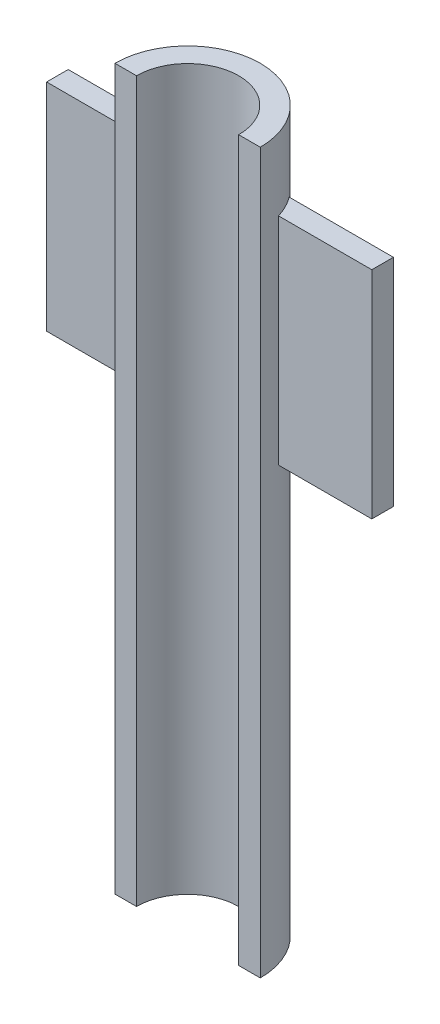
from build123d import *

# Parameters (mm, degrees)
SKETCH1_R           = 10.1
SKETCH1_R_2         = 7.1
BOSS_EXTRUDE1_DEPTH = 50
SKETCH3_W           = 203.170281232
SKETCH3_H           = 205.602397066
CUT_EXTRUDE1_DEPTH  = 53.000192307
SKETCH6_W           = 15
SKETCH6_H           = 30
BOSS_EXTRUDE4_DEPTH = 1.5
BOSS_EXTRUDE5_DEPTH = 1.5


with BuildPart() as part:
    # Sketch1 → Boss-Extrude1 (new, symmetric)
    with BuildSketch(Plane(origin=(0, 0, 0), x_dir=(1, 0, 0), z_dir=(0, 1, 0))):
        with Locations(Location((0, 0, 0), (0, 0, 270))):
            Circle(SKETCH1_R)
        with Locations(Location((0, 0, 0), (0, 0, 270))):
            Circle(SKETCH1_R_2, mode=Mode.SUBTRACT)
    extrude(amount=BOSS_EXTRUDE1_DEPTH, both=True)

    # Sketch3 → Cut-Extrude1 (cut, through all)
    with BuildSketch(Plane.XY):
        Rectangle(SKETCH3_W, SKETCH3_H)
    extrude(amount=CUT_EXTRUDE1_DEPTH, mode=Mode.SUBTRACT)

    # Sketch6 → Boss-Extrude4 (add, symmetric)
    with BuildSketch(Plane.XY.offset(-4.5)):
        with Locations((15.1, 25)):
            Rectangle(SKETCH6_W, SKETCH6_H)
        with Locations((-15.1, 25)):
            Rectangle(SKETCH6_W, SKETCH6_H)
    extrude(amount=BOSS_EXTRUDE4_DEPTH, both=True)

    # Sketch7 → Boss-Extrude5 (add)
    # profile 1 of 10: a face of its own
    with BuildSketch(Plane(origin=(0, 0, -6), x_dir=(-1, 0, 0), z_dir=(0, 0, -1))):
        Polygon((18.272743586, 27.57751444), (18.272743586, 27.119263739), (15.362326919, 26.380582265), (15.362326919, 26.917540148), (15.996648501, 27.078452608), (15.996648501, 28.213585069), (15.362326919, 28.554066506), (15.362326919, 29.141746795), align=None)
        Polygon((16.481717945, 27.202635049), (17.430285236, 27.442254691), (16.481717945, 27.952976846), align=None, mode=Mode.SUBTRACT)
    # profile 2 of 10: a face of its own
    with BuildSketch(Plane(origin=(0, 0, -6), x_dir=(-1, 0, 0), z_dir=(0, 0, -1))):
        with BuildLine():
            Line((17.4145438, 25.298504274), (17.4145438, 25.820886752))
            add(Edge.make_bspline(
                [(17.4145438, 25.820886752), (17.460723136, 25.817842501), (17.550828394, 25.811902549), (17.680949713, 25.785822497), (17.802249114, 25.746851672), (17.913494395, 25.694287528), (18.01420003, 25.630921257), (18.102459696, 25.557128683), (18.177734624, 25.473117632), (18.239354644, 25.379621177), (18.28823979, 25.278082916), (18.322543695, 25.169324736), (18.343459462, 25.053857316), (18.346046688, 24.97463113), (18.347369654, 24.934119174)],
                knots=[0, 0, 0, 0, 1.15710901, 2.257754567, 3.311243163, 4.338082744, 5.328386743, 6.281089782, 7.20757636, 8.14096805, 9.07413166, 10.01848154, 10.986759394, 12, 12, 12, 12], degree=3))
            add(Edge.make_bspline(
                [(18.347369654, 24.934119174), (18.346771729, 24.904737387), (18.345599109, 24.847115318), (18.334177733, 24.762575129), (18.315677219, 24.68213456), (18.289727639, 24.605363058), (18.256653549, 24.532614201), (18.215926297, 24.463688741), (18.167982877, 24.398724436), (18.112815906, 24.338629381), (18.052444976, 24.284039173), (17.987956896, 24.235817534), (17.919908141, 24.194892896), (17.847838052, 24.161988294), (17.772406308, 24.136367619), (17.693387308, 24.117648964), (17.610769337, 24.106289693), (17.554503892, 24.10509469), (17.525899886, 24.104487179)],
                knots=[0, 0, 0, 0, 1.079543272, 2.117145465, 3.12912697, 4.109553083, 5.090967661, 6.061295998, 7.0471464, 8.053388092, 9.054825723, 10.034939483, 11.008916128, 11.967870454, 12.941532676, 13.932648969, 14.949008208, 16, 16, 16, 16], degree=3))
            add(Edge.make_bspline(
                [(17.525899886, 24.104487179), (17.502355613, 24.105045103), (17.454721149, 24.106173885), (17.382887449, 24.115609666), (17.309481508, 24.129253991), (17.234941311, 24.150296346), (17.158448595, 24.175637013), (17.080880515, 24.207685653), (17.001319326, 24.24408704), (16.934450122, 24.280354228), (16.878391005, 24.313081833), (16.832930166, 24.342610056), (16.78378104, 24.375547026), (16.732245586, 24.414104332), (16.675906204, 24.454885664), (16.617512121, 24.501462736), (16.554705169, 24.550642107), (16.489654767, 24.605227565), (16.420809393, 24.663471175), (16.348604942, 24.725741777), (16.273159486, 24.792364258), (16.194868773, 24.863568319), (16.112232811, 24.938113086), (16.027022099, 25.017342868), (15.93794995, 25.100245909), (15.878042884, 25.157351695), (15.847396364, 25.186565171)],
                knots=[0, 0, 0, 0, 0.830114445, 1.679476586, 2.551951687, 3.461549647, 4.408799845, 5.392739447, 6.420129466, 7.493481945, 8.074224777, 8.709302655, 9.40513743, 10.16057533, 10.979032967, 11.857973419, 12.79467404, 13.792554112, 14.852781522, 15.975451208, 17.155498061, 18.4027528, 19.708099789, 21.080817988, 22.506640743, 24, 24, 24, 24], degree=3))
            Line((15.847396364, 25.186565171), (15.847396364, 24.216426282))
            Line((15.847396364, 24.216426282), (15.362326919, 24.28055806))
            Line((15.362326919, 24.28055806), (15.362326919, 26.044764957))
            Line((15.362326919, 26.044764957), (15.735457261, 26.007451923))
            add(Edge.make_bspline(
                [(15.735457261, 26.007451923), (15.766944672, 25.977334255), (15.828529575, 25.918428375), (15.918649125, 25.832074941), (16.005377199, 25.750529369), (16.087326389, 25.672123697), (16.166044816, 25.598503706), (16.240306696, 25.52816793), (16.310446248, 25.461866187), (16.377151443, 25.400130599), (16.439422625, 25.342078172), (16.498566254, 25.28895232), (16.552382242, 25.238334049), (16.60327136, 25.193055984), (16.650107886, 25.151689485), (16.69223595, 25.113689652), (16.731093904, 25.080501281), (16.755357924, 25.059480282), (16.766812847, 25.049556374)],
                knots=[0, 0, 0, 0, 1.485706908, 2.905831718, 4.255813778, 5.544779497, 6.772986801, 7.930802167, 9.032413688, 10.063933681, 11.029901119, 11.935210493, 12.774579406, 13.548857665, 14.257643472, 14.905346069, 15.483219369, 16, 16, 16, 16], degree=3))
            add(Edge.make_bspline(
                [(16.766812847, 25.049556374), (16.795311298, 25.025957683), (16.850014649, 24.980659523), (16.929647764, 24.916957255), (17.004071533, 24.861070822), (17.071820341, 24.811209327), (17.134628836, 24.769088351), (17.19121192, 24.733568057), (17.242039137, 24.704949745), (17.27471379, 24.690215435), (17.289778342, 24.683422226)],
                knots=[0, 0, 0, 0, 1.387145642, 2.662653962, 3.822537019, 4.876163332, 5.815785708, 6.656796686, 7.380720103, 8, 8, 8, 8], degree=3))
            add(Edge.make_bspline(
                [(17.289778342, 24.683422226), (17.311218487, 24.674890042), (17.353130885, 24.658210851), (17.416856772, 24.639956039), (17.479654239, 24.629002213), (17.521194898, 24.627573081), (17.541641322, 24.626869658)],
                knots=[0, 0, 0, 0, 1.065166925, 2.082248014, 3.056077273, 4, 4, 4, 4], degree=3))
            add(Edge.make_bspline(
                [(17.541641322, 24.626869658), (17.563696901, 24.628037645), (17.606692401, 24.630314539), (17.668434759, 24.646692604), (17.723892203, 24.675453516), (17.771974485, 24.714744512), (17.812354356, 24.761412802), (17.84156305, 24.81505383), (17.858999232, 24.873971992), (17.861184988, 24.914956837), (17.86230021, 24.935868222)],
                knots=[0, 0, 0, 0, 1.065210966, 2.076539412, 3.059259361, 4.060863691, 5.060000142, 6.022229399, 6.990897182, 8, 8, 8, 8], degree=3))
            add(Edge.make_bspline(
                [(17.86230021, 24.935868222), (17.861123833, 24.958167086), (17.858839621, 25.001465564), (17.839267431, 25.063443828), (17.807090982, 25.119318656), (17.769863632, 25.160201459), (17.733556801, 25.189394042), (17.70166148, 25.210342627), (17.664739281, 25.229014994), (17.623620714, 25.246299628), (17.577864825, 25.262124411), (17.527513097, 25.275773079), (17.472815601, 25.289003934), (17.434417745, 25.295264126), (17.4145438, 25.298504274)],
                knots=[0, 0, 0, 0, 1.261989429, 2.450448752, 3.644971293, 4.893175475, 5.559158705, 6.283478895, 7.052279547, 7.901593451, 8.811103815, 9.794938439, 10.858705195, 12, 12, 12, 12], degree=3))
        make_face()
    # profile 3 of 10: a face of its own
    with BuildSketch(Plane(origin=(0, 0, -6), x_dir=(-1, 0, 0), z_dir=(0, 0, -1))):
        Polygon((18.272743586, 23.288847573), (18.272743586, 22.800280031), (16.293986742, 21.772422543), (18.272743586, 21.494906851), (18.272743586, 20.967860243), (15.362326919, 21.375388538), (15.362326919, 21.861040999), (17.362655362, 22.891813568), (15.362326919, 23.171661325), (15.362326919, 23.698124917), align=None)
    # profile 4 of 10: a face of its own
    with BuildSketch(Plane(origin=(0, 0, -6), x_dir=(-1, 0, 0), z_dir=(0, 0, -1))):
        with BuildLine():
            Line((11.302658116, 34.682732372), (11.302658116, 35.20511485))
            add(Edge.make_bspline(
                [(11.302658116, 35.20511485), (11.348837452, 35.202070599), (11.438942711, 35.196130647), (11.569064029, 35.170050595), (11.69036343, 35.13107977), (11.801608711, 35.078515626), (11.902314346, 35.015149355), (11.990574012, 34.941356781), (12.065848941, 34.85734573), (12.12746896, 34.763849275), (12.176354106, 34.662311014), (12.210658011, 34.553552834), (12.231573778, 34.438085414), (12.234161004, 34.358859228), (12.235483971, 34.318347272)],
                knots=[0, 0, 0, 0, 1.15710901, 2.257754567, 3.311243163, 4.338082744, 5.328386743, 6.281089782, 7.20757636, 8.14096805, 9.07413166, 10.01848154, 10.986759394, 12, 12, 12, 12], degree=3))
            add(Edge.make_bspline(
                [(12.235483971, 34.318347272), (12.234886046, 34.288965485), (12.233713425, 34.231343416), (12.22229205, 34.146803227), (12.203791536, 34.066362658), (12.177841956, 33.989591156), (12.144767865, 33.916842299), (12.104040613, 33.847916839), (12.056097193, 33.782952534), (12.000930223, 33.722857479), (11.940559293, 33.668267271), (11.876071212, 33.620045633), (11.808022457, 33.579120994), (11.735952368, 33.546216393), (11.660520624, 33.520595717), (11.581501624, 33.501877062), (11.498883654, 33.490517792), (11.442618208, 33.489322789), (11.414014202, 33.488715278)],
                knots=[0, 0, 0, 0, 1.079543272, 2.117145465, 3.12912697, 4.109553083, 5.090967661, 6.061295998, 7.0471464, 8.053388092, 9.054825723, 10.034939483, 11.008916128, 11.967870454, 12.941532676, 13.932648969, 14.949008208, 16, 16, 16, 16], degree=3))
            add(Edge.make_bspline(
                [(11.414014202, 33.488715278), (11.390469929, 33.489273201), (11.342835465, 33.490401983), (11.271001765, 33.499837764), (11.197595824, 33.513482089), (11.123055627, 33.534524445), (11.046562911, 33.559865112), (10.968994831, 33.591913752), (10.889433642, 33.628315138), (10.822564438, 33.664582326), (10.766505321, 33.697309931), (10.721044482, 33.726838155), (10.671895356, 33.759775124), (10.620359902, 33.79833243), (10.56402052, 33.839113762), (10.505626437, 33.885690834), (10.442819485, 33.934870205), (10.377769083, 33.989455663), (10.308923709, 34.047699273), (10.236719258, 34.109969876), (10.161273802, 34.176592357), (10.082983089, 34.247796417), (10.000347127, 34.322341185), (9.915136415, 34.401570966), (9.826064266, 34.484474007), (9.7661572, 34.541579793), (9.73551068, 34.570793269)],
                knots=[0, 0, 0, 0, 0.830114445, 1.679476586, 2.551951687, 3.461549647, 4.408799845, 5.392739447, 6.420129466, 7.493481945, 8.074224777, 8.709302655, 9.40513743, 10.16057533, 10.979032967, 11.857973419, 12.79467404, 13.792554112, 14.852781522, 15.975451208, 17.155498061, 18.4027528, 19.708099789, 21.080817988, 22.506640743, 24, 24, 24, 24], degree=3))
            Line((9.73551068, 34.570793269), (9.73551068, 33.60065438))
            Line((9.73551068, 33.60065438), (9.250441236, 33.664786158))
            Line((9.250441236, 33.664786158), (9.250441236, 35.428993056))
            Line((9.250441236, 35.428993056), (9.623571578, 35.391680021))
            add(Edge.make_bspline(
                [(9.623571578, 35.391680021), (9.655058988, 35.361562354), (9.716643891, 35.302656473), (9.806763442, 35.216303039), (9.893491515, 35.134757467), (9.975440705, 35.056351795), (10.054159132, 34.982731805), (10.128421013, 34.912396028), (10.198560564, 34.846094285), (10.265265759, 34.784358697), (10.327536941, 34.726306271), (10.38668057, 34.673180418), (10.440496558, 34.622562148), (10.491385676, 34.577284082), (10.538222202, 34.535917583), (10.580350266, 34.497917751), (10.61920822, 34.464729379), (10.643472241, 34.44370838), (10.654927163, 34.433784472)],
                knots=[0, 0, 0, 0, 1.485706908, 2.905831718, 4.255813778, 5.544779497, 6.772986801, 7.930802167, 9.032413688, 10.063933681, 11.029901119, 11.935210493, 12.774579406, 13.548857665, 14.257643472, 14.905346069, 15.483219369, 16, 16, 16, 16], degree=3))
            add(Edge.make_bspline(
                [(10.654927163, 34.433784472), (10.683425614, 34.410185782), (10.738128965, 34.364887621), (10.81776208, 34.301185353), (10.892185849, 34.24529892), (10.959934658, 34.195437425), (11.022743153, 34.153316449), (11.079326236, 34.117796155), (11.130153454, 34.089177843), (11.162828106, 34.074443533), (11.177892658, 34.067650324)],
                knots=[0, 0, 0, 0, 1.387145642, 2.662653962, 3.822537019, 4.876163332, 5.815785708, 6.656796686, 7.380720103, 8, 8, 8, 8], degree=3))
            add(Edge.make_bspline(
                [(11.177892658, 34.067650324), (11.199332803, 34.05911814), (11.241245202, 34.042438949), (11.304971089, 34.024184138), (11.367768555, 34.013230312), (11.409309214, 34.011801179), (11.429755639, 34.011097756)],
                knots=[0, 0, 0, 0, 1.065166925, 2.082248014, 3.056077273, 4, 4, 4, 4], degree=3))
            add(Edge.make_bspline(
                [(11.429755639, 34.011097756), (11.451811217, 34.012265744), (11.494806717, 34.014542637), (11.556549076, 34.030920702), (11.612006519, 34.059681614), (11.660088801, 34.09897261), (11.700468672, 34.1456409), (11.729677366, 34.199281929), (11.747113548, 34.258200091), (11.749299305, 34.299184936), (11.750414526, 34.320096321)],
                knots=[0, 0, 0, 0, 1.065210966, 2.076539412, 3.059259361, 4.060863691, 5.060000142, 6.022229399, 6.990897182, 8, 8, 8, 8], degree=3))
            add(Edge.make_bspline(
                [(11.750414526, 34.320096321), (11.749238149, 34.342395184), (11.746953937, 34.385693663), (11.727381747, 34.447671926), (11.695205298, 34.503546754), (11.657977948, 34.544429557), (11.621671117, 34.57362214), (11.589775796, 34.594570725), (11.552853597, 34.613243093), (11.51173503, 34.630527726), (11.465979141, 34.646352509), (11.415627413, 34.660001177), (11.360929917, 34.673232032), (11.322532062, 34.679492224), (11.302658116, 34.682732372)],
                knots=[0, 0, 0, 0, 1.261989429, 2.450448752, 3.644971293, 4.893175475, 5.559158705, 6.283478895, 7.052279547, 7.901593451, 8.811103815, 9.794938439, 10.858705195, 12, 12, 12, 12], degree=3))
        make_face()
    # profile 5 of 10: a face of its own
    with BuildSketch(Plane(origin=(0, 0, -6), x_dir=(-1, 0, 0), z_dir=(0, 0, -1))):
        with BuildLine():
            Line((11.377284184, 32.8508956), (11.377284184, 32.323848992))
            Line((11.377284184, 32.323848992), (11.158070108, 32.355331864))
            add(Edge.make_bspline(
                [(11.158070108, 32.355331864), (11.17845255, 32.331531266), (11.218516689, 32.284748326), (11.271411753, 32.21058849), (11.315004701, 32.133704433), (11.351913685, 32.055205332), (11.379507223, 31.973926554), (11.40046442, 31.890775942), (11.412066365, 31.805293713), (11.413750192, 31.747666708), (11.414597219, 31.718678218)],
                knots=[0, 0, 0, 0, 1.069944556, 2.103104732, 3.105026839, 4.085031541, 5.061094812, 6.031817439, 7.009932236, 8, 8, 8, 8], degree=3))
            add(Edge.make_bspline(
                [(11.414597219, 31.718678218), (11.414111375, 31.695127751), (11.413151781, 31.648612996), (11.403284636, 31.580165974), (11.38847776, 31.513847859), (11.366696943, 31.451098382), (11.341345749, 31.39201887), (11.311742518, 31.338570604), (11.278776973, 31.290682663), (11.242216787, 31.247887786), (11.199843536, 31.20936194), (11.149349289, 31.176294751), (11.09304733, 31.143470891), (11.051420014, 31.126050462), (11.029806553, 31.117005542)],
                knots=[0, 0, 0, 0, 1.109749996, 2.191877839, 3.254428669, 4.309245986, 5.318789372, 6.282718316, 7.1850953, 8.055788369, 8.931721845, 9.874689478, 10.896510289, 12, 12, 12, 12], degree=3))
            add(Edge.make_bspline(
                [(11.029806553, 31.117005542), (11.059981896, 31.092036611), (11.119327443, 31.042930461), (11.196260178, 30.958487395), (11.263196743, 30.868817967), (11.317452797, 30.772732583), (11.360928236, 30.672939246), (11.39206404, 30.57047788), (11.410615985, 30.465865474), (11.413268542, 30.395497954), (11.414597219, 30.360250568)],
                knots=[0, 0, 0, 0, 1.068543251, 2.101493426, 3.111064263, 4.119001297, 5.107976983, 6.078506366, 7.037515749, 8, 8, 8, 8], degree=3))
            add(Edge.make_bspline(
                [(11.414597219, 30.360250568), (11.414012452, 30.338265269), (11.412864667, 30.295112374), (11.40459811, 30.232061388), (11.3910683, 30.171976061), (11.372567237, 30.114599025), (11.347973752, 30.060005253), (11.31729767, 30.008807602), (11.282301842, 29.959778091), (11.24145882, 29.91483508), (11.197010859, 29.873288006), (11.148109847, 29.837606103), (11.096367991, 29.807240652), (11.041144783, 29.782589176), (10.983165636, 29.762456023), (10.921241755, 29.749453063), (10.856494192, 29.741043121), (10.812174649, 29.739913595), (10.789603896, 29.739338358)],
                knots=[0, 0, 0, 0, 1.067640865, 2.095572803, 3.082514936, 4.055593237, 5.018778766, 5.98358166, 6.950275738, 7.939517124, 8.928127875, 9.900381805, 10.87332276, 11.83650829, 12.833464925, 13.848049363, 14.904069359, 16, 16, 16, 16], degree=3))
            add(Edge.make_bspline(
                [(10.789603896, 29.739338358), (10.771138154, 29.739600923), (10.732040123, 29.74015686), (10.670180759, 29.743724336), (10.602014411, 29.750503231), (10.554448037, 29.755805619), (10.529578689, 29.758577891)],
                knots=[0, 0, 0, 0, 0.849407055, 1.7984733, 2.848965608, 4, 4, 4, 4], degree=3))
            Line((10.529578689, 29.758577891), (9.250441236, 29.939312901))
            Line((9.250441236, 29.939312901), (9.250441236, 30.466359509))
            Line((9.250441236, 30.466359509), (10.350592728, 30.310694194))
            add(Edge.make_bspline(
                [(10.350592728, 30.310694194), (10.367686815, 30.30830242), (10.400298308, 30.303739479), (10.446995864, 30.298153624), (10.488916286, 30.292620595), (10.526469345, 30.288731736), (10.559470096, 30.285057011), (10.588045289, 30.282648239), (10.612164722, 30.281517861), (10.626747457, 30.281134217), (10.633355565, 30.28096037)],
                knots=[0, 0, 0, 0, 1.456211658, 2.778109005, 3.967816617, 5.02342619, 5.963168411, 6.769250698, 7.442290898, 8, 8, 8, 8], degree=3))
            add(Edge.make_bspline(
                [(10.633355565, 30.28096037), (10.65619502, 30.281663672), (10.699487382, 30.282996786), (10.759858093, 30.298034533), (10.812307505, 30.321070312), (10.85523429, 30.355308986), (10.888765097, 30.397980396), (10.913336746, 30.448347913), (10.927148191, 30.506638421), (10.928709097, 30.547907979), (10.929527774, 30.569553369)],
                knots=[0, 0, 0, 0, 1.162032896, 2.202642356, 3.151455489, 4.061391288, 4.971327087, 5.897518753, 6.897273766, 8, 8, 8, 8], degree=3))
            add(Edge.make_bspline(
                [(10.929527774, 30.569553369), (10.928397565, 30.592020803), (10.926103713, 30.637620287), (10.907126816, 30.705477922), (10.878576842, 30.773832244), (10.837523411, 30.840389235), (10.788400015, 30.903904498), (10.730416696, 30.960683004), (10.664844911, 31.009376483), (10.603258184, 31.042546751), (10.548061737, 31.065925119), (10.499218613, 31.082343736), (10.443876565, 31.098828631), (10.381457117, 31.113625748), (10.312381195, 31.129011968), (10.236113752, 31.142784836), (10.153021404, 31.155385598), (10.095433714, 31.163506466), (10.065497826, 31.167727948)],
                knots=[0, 0, 0, 0, 0.931587006, 1.890731508, 2.906980965, 4.000380382, 5.127221203, 6.234353763, 7.359372456, 8.507768278, 9.129810107, 9.846978072, 10.646264026, 11.527073862, 12.510095012, 13.584900552, 14.744555564, 16, 16, 16, 16], degree=3))
            Line((10.065497826, 31.167727948), (9.250441236, 31.282582131))
            Line((9.250441236, 31.282582131), (9.250441236, 31.809628739))
            Line((9.250441236, 31.809628739), (10.415307522, 31.645218182))
            add(Edge.make_bspline(
                [(10.415307522, 31.645218182), (10.436675965, 31.642429707), (10.478005801, 31.637036369), (10.537436304, 31.630389974), (10.592303611, 31.626756188), (10.627132249, 31.626230823), (10.643849856, 31.625978649)],
                knots=[0, 0, 0, 0, 1.126647165, 2.179107802, 3.125979013, 4, 4, 4, 4], degree=3))
            add(Edge.make_bspline(
                [(10.643849856, 31.625978649), (10.664742281, 31.626948965), (10.704986277, 31.628818035), (10.76183127, 31.644117646), (10.811947347, 31.669747816), (10.853962331, 31.705811979), (10.888227357, 31.749734782), (10.912223218, 31.801187502), (10.927326638, 31.85871935), (10.92877524, 31.899313533), (10.929527774, 31.92040181)],
                knots=[0, 0, 0, 0, 1.082943702, 2.08601841, 3.028769941, 3.980487733, 4.936683719, 5.897548763, 6.907797403, 8, 8, 8, 8], degree=3))
            add(Edge.make_bspline(
                [(10.929527774, 31.92040181), (10.92853587, 31.941883151), (10.926515128, 31.985645684), (10.908902511, 32.0509805), (10.8817729, 32.117055904), (10.843864588, 32.182322937), (10.798460363, 32.245727405), (10.742574622, 32.30137587), (10.679886875, 32.350243687), (10.621120431, 32.384195727), (10.569275264, 32.408344916), (10.524672544, 32.424903062), (10.475438456, 32.44143854), (10.420927743, 32.455569665), (10.361855057, 32.469633705), (10.297989453, 32.483212847), (10.22884324, 32.494553094), (10.181139541, 32.501547004), (10.156448347, 32.505167017)],
                knots=[0, 0, 0, 0, 0.967289281, 1.970595297, 3.031757784, 4.18188025, 5.366870776, 6.53816982, 7.725006302, 8.942575235, 9.589588456, 10.302516126, 11.08685556, 11.930867226, 12.840704751, 13.825621188, 14.874552524, 16, 16, 16, 16], degree=3))
            Line((10.156448347, 32.505167017), (9.250441236, 32.625851362))
            Line((9.250441236, 32.625851362), (9.250441236, 33.15289797))
            Line((9.250441236, 33.15289797), (11.377284184, 32.8508956))
        make_face()
    # profile 6 of 10: a face of its own
    with BuildSketch(Plane(origin=(0, 0, -6), x_dir=(-1, 0, 0), z_dir=(0, 0, -1))):
        with BuildLine():
            Line((11.377284184, 29.044966112), (11.377284184, 28.517919505))
            Line((11.377284184, 28.517919505), (11.158070108, 28.549402377))
            add(Edge.make_bspline(
                [(11.158070108, 28.549402377), (11.17845255, 28.525601778), (11.218516689, 28.478818839), (11.271411753, 28.404659003), (11.315004701, 28.327774945), (11.351913685, 28.249275845), (11.379507223, 28.167997067), (11.40046442, 28.084846455), (11.412066365, 27.999364226), (11.413750192, 27.941737221), (11.414597219, 27.912748731)],
                knots=[0, 0, 0, 0, 1.069944556, 2.103104732, 3.105026839, 4.085031541, 5.061094812, 6.031817439, 7.009932236, 8, 8, 8, 8], degree=3))
            add(Edge.make_bspline(
                [(11.414597219, 27.912748731), (11.414111375, 27.889198263), (11.413151781, 27.842683509), (11.403284636, 27.774236487), (11.38847776, 27.707918372), (11.366696943, 27.645168895), (11.341345749, 27.586089383), (11.311742518, 27.532641117), (11.278776973, 27.484753176), (11.242216787, 27.441958299), (11.199843536, 27.403432453), (11.149349289, 27.370365264), (11.09304733, 27.337541404), (11.051420014, 27.320120975), (11.029806553, 27.311076055)],
                knots=[0, 0, 0, 0, 1.109749996, 2.191877839, 3.254428669, 4.309245986, 5.318789372, 6.282718316, 7.1850953, 8.055788369, 8.931721845, 9.874689478, 10.896510289, 12, 12, 12, 12], degree=3))
            add(Edge.make_bspline(
                [(11.029806553, 27.311076055), (11.059981896, 27.286107124), (11.119327443, 27.237000974), (11.196260178, 27.152557908), (11.263196743, 27.062888479), (11.317452797, 26.966803096), (11.360928236, 26.867009759), (11.39206404, 26.764548393), (11.410615985, 26.659935987), (11.413268542, 26.589568467), (11.414597219, 26.55432108)],
                knots=[0, 0, 0, 0, 1.068543251, 2.101493426, 3.111064263, 4.119001297, 5.107976983, 6.078506366, 7.037515749, 8, 8, 8, 8], degree=3))
            add(Edge.make_bspline(
                [(11.414597219, 26.55432108), (11.414012452, 26.532335782), (11.412864667, 26.489182887), (11.40459811, 26.426131901), (11.3910683, 26.366046574), (11.372567237, 26.308669538), (11.347973752, 26.254075766), (11.31729767, 26.202878114), (11.282301842, 26.153848604), (11.24145882, 26.108905593), (11.197010859, 26.067358519), (11.148109847, 26.031676616), (11.096367991, 26.001311165), (11.041144783, 25.976659688), (10.983165636, 25.956526536), (10.921241755, 25.943523576), (10.856494192, 25.935113634), (10.812174649, 25.933984108), (10.789603896, 25.933408871)],
                knots=[0, 0, 0, 0, 1.067640865, 2.095572803, 3.082514936, 4.055593237, 5.018778766, 5.98358166, 6.950275738, 7.939517124, 8.928127875, 9.900381805, 10.87332276, 11.83650829, 12.833464925, 13.848049363, 14.904069359, 16, 16, 16, 16], degree=3))
            add(Edge.make_bspline(
                [(10.789603896, 25.933408871), (10.771138154, 25.933671436), (10.732040123, 25.934227373), (10.670180759, 25.937794848), (10.602014411, 25.944573743), (10.554448037, 25.949876132), (10.529578689, 25.952648404)],
                knots=[0, 0, 0, 0, 0.849407055, 1.7984733, 2.848965608, 4, 4, 4, 4], degree=3))
            Line((10.529578689, 25.952648404), (9.250441236, 26.133383413))
            Line((9.250441236, 26.133383413), (9.250441236, 26.660430021))
            Line((9.250441236, 26.660430021), (10.350592728, 26.504764707))
            add(Edge.make_bspline(
                [(10.350592728, 26.504764707), (10.367686815, 26.502372933), (10.400298308, 26.497809992), (10.446995864, 26.492224137), (10.488916286, 26.486691108), (10.526469345, 26.482802249), (10.559470096, 26.479127524), (10.588045289, 26.476718752), (10.612164722, 26.475588374), (10.626747457, 26.47520473), (10.633355565, 26.475030883)],
                knots=[0, 0, 0, 0, 1.456211658, 2.778109005, 3.967816617, 5.02342619, 5.963168411, 6.769250698, 7.442290898, 8, 8, 8, 8], degree=3))
            add(Edge.make_bspline(
                [(10.633355565, 26.475030883), (10.65619502, 26.475734185), (10.699487382, 26.477067299), (10.759858093, 26.492105045), (10.812307505, 26.515140825), (10.85523429, 26.549379499), (10.888765097, 26.592050909), (10.913336746, 26.642418426), (10.927148191, 26.700708933), (10.928709097, 26.741978492), (10.929527774, 26.763623882)],
                knots=[0, 0, 0, 0, 1.162032896, 2.202642356, 3.151455489, 4.061391288, 4.971327087, 5.897518753, 6.897273766, 8, 8, 8, 8], degree=3))
            add(Edge.make_bspline(
                [(10.929527774, 26.763623882), (10.928397565, 26.786091316), (10.926103713, 26.8316908), (10.907126816, 26.899548435), (10.878576842, 26.967902757), (10.837523411, 27.034459748), (10.788400015, 27.097975011), (10.730416696, 27.154753516), (10.664844911, 27.203446996), (10.603258184, 27.236617264), (10.548061737, 27.259995632), (10.499218613, 27.276414249), (10.443876565, 27.292899144), (10.381457117, 27.307696261), (10.312381195, 27.323082481), (10.236113752, 27.336855349), (10.153021404, 27.349456111), (10.095433714, 27.357576979), (10.065497826, 27.361798461)],
                knots=[0, 0, 0, 0, 0.931587006, 1.890731508, 2.906980965, 4.000380382, 5.127221203, 6.234353763, 7.359372456, 8.507768278, 9.129810107, 9.846978072, 10.646264026, 11.527073862, 12.510095012, 13.584900552, 14.744555564, 16, 16, 16, 16], degree=3))
            Line((10.065497826, 27.361798461), (9.250441236, 27.476652644))
            Line((9.250441236, 27.476652644), (9.250441236, 28.003699252))
            Line((9.250441236, 28.003699252), (10.415307522, 27.839288695))
            add(Edge.make_bspline(
                [(10.415307522, 27.839288695), (10.436675965, 27.83650022), (10.478005801, 27.831106882), (10.537436304, 27.824460487), (10.592303611, 27.820826701), (10.627132249, 27.820301335), (10.643849856, 27.820049162)],
                knots=[0, 0, 0, 0, 1.126647165, 2.179107802, 3.125979013, 4, 4, 4, 4], degree=3))
            add(Edge.make_bspline(
                [(10.643849856, 27.820049162), (10.664742281, 27.821019478), (10.704986277, 27.822888548), (10.76183127, 27.838188159), (10.811947347, 27.863818328), (10.853962331, 27.899882492), (10.888227357, 27.943805295), (10.912223218, 27.995258015), (10.927326638, 28.052789863), (10.92877524, 28.093384046), (10.929527774, 28.114472322)],
                knots=[0, 0, 0, 0, 1.082943702, 2.08601841, 3.028769941, 3.980487733, 4.936683719, 5.897548763, 6.907797403, 8, 8, 8, 8], degree=3))
            add(Edge.make_bspline(
                [(10.929527774, 28.114472322), (10.92853587, 28.135953664), (10.926515128, 28.179716197), (10.908902511, 28.245051013), (10.8817729, 28.311126417), (10.843864588, 28.37639345), (10.798460363, 28.439797918), (10.742574622, 28.495446383), (10.679886875, 28.5443142), (10.621120431, 28.57826624), (10.569275264, 28.602415429), (10.524672544, 28.618973575), (10.475438456, 28.635509052), (10.420927743, 28.649640177), (10.361855057, 28.663704218), (10.297989453, 28.677283359), (10.22884324, 28.688623606), (10.181139541, 28.695617517), (10.156448347, 28.69923753)],
                knots=[0, 0, 0, 0, 0.967289281, 1.970595297, 3.031757784, 4.18188025, 5.366870776, 6.53816982, 7.725006302, 8.942575235, 9.589588456, 10.302516126, 11.08685556, 11.930867226, 12.840704751, 13.825621188, 14.874552524, 16, 16, 16, 16], degree=3))
            Line((10.156448347, 28.69923753), (9.250441236, 28.819921875))
            Line((9.250441236, 28.819921875), (9.250441236, 29.346968483))
            Line((9.250441236, 29.346968483), (11.377284184, 29.044966112))
        make_face()
    # profile 7 of 10: a face of its own
    with BuildSketch(Plane(origin=(0, 0, -6), x_dir=(-1, 0, 0), z_dir=(0, 0, -1))):
        with BuildLine():
            Line((11.377284184, 24.1196456), (11.377284184, 23.592598992))
            Line((11.377284184, 23.592598992), (11.158070108, 23.624081864))
            add(Edge.make_bspline(
                [(11.158070108, 23.624081864), (11.17845255, 23.600281266), (11.218516689, 23.553498326), (11.271411753, 23.47933849), (11.315004701, 23.402454433), (11.351913685, 23.323955332), (11.379507223, 23.242676554), (11.40046442, 23.159525942), (11.412066365, 23.074043713), (11.413750192, 23.016416708), (11.414597219, 22.987428218)],
                knots=[0, 0, 0, 0, 1.069944556, 2.103104732, 3.105026839, 4.085031541, 5.061094812, 6.031817439, 7.009932236, 8, 8, 8, 8], degree=3))
            add(Edge.make_bspline(
                [(11.414597219, 22.987428218), (11.414111375, 22.963877751), (11.413151781, 22.917362996), (11.403284636, 22.848915974), (11.38847776, 22.782597859), (11.366696943, 22.719848382), (11.341345749, 22.66076887), (11.311742518, 22.607320604), (11.278776973, 22.559432663), (11.242216787, 22.516637786), (11.199843536, 22.47811194), (11.149349289, 22.445044751), (11.09304733, 22.412220891), (11.051420014, 22.394800462), (11.029806553, 22.385755542)],
                knots=[0, 0, 0, 0, 1.109749996, 2.191877839, 3.254428669, 4.309245986, 5.318789372, 6.282718316, 7.1850953, 8.055788369, 8.931721845, 9.874689478, 10.896510289, 12, 12, 12, 12], degree=3))
            add(Edge.make_bspline(
                [(11.029806553, 22.385755542), (11.059981896, 22.360786611), (11.119327443, 22.311680461), (11.196260178, 22.227237395), (11.263196743, 22.137567967), (11.317452797, 22.041482583), (11.360928236, 21.941689246), (11.39206404, 21.83922788), (11.410615985, 21.734615474), (11.413268542, 21.664247954), (11.414597219, 21.629000568)],
                knots=[0, 0, 0, 0, 1.068543251, 2.101493426, 3.111064263, 4.119001297, 5.107976983, 6.078506366, 7.037515749, 8, 8, 8, 8], degree=3))
            add(Edge.make_bspline(
                [(11.414597219, 21.629000568), (11.414012452, 21.607015269), (11.412864667, 21.563862374), (11.40459811, 21.500811388), (11.3910683, 21.440726061), (11.372567237, 21.383349025), (11.347973752, 21.328755253), (11.31729767, 21.277557602), (11.282301842, 21.228528091), (11.24145882, 21.18358508), (11.197010859, 21.142038006), (11.148109847, 21.106356103), (11.096367991, 21.075990652), (11.041144783, 21.051339176), (10.983165636, 21.031206023), (10.921241755, 21.018203063), (10.856494192, 21.009793121), (10.812174649, 21.008663595), (10.789603896, 21.008088358)],
                knots=[0, 0, 0, 0, 1.067640865, 2.095572803, 3.082514936, 4.055593237, 5.018778766, 5.98358166, 6.950275738, 7.939517124, 8.928127875, 9.900381805, 10.87332276, 11.83650829, 12.833464925, 13.848049363, 14.904069359, 16, 16, 16, 16], degree=3))
            add(Edge.make_bspline(
                [(10.789603896, 21.008088358), (10.771138154, 21.008350923), (10.732040123, 21.00890686), (10.670180759, 21.012474336), (10.602014411, 21.019253231), (10.554448037, 21.024555619), (10.529578689, 21.027327891)],
                knots=[0, 0, 0, 0, 0.849407055, 1.7984733, 2.848965608, 4, 4, 4, 4], degree=3))
            Line((10.529578689, 21.027327891), (9.250441236, 21.208062901))
            Line((9.250441236, 21.208062901), (9.250441236, 21.735109509))
            Line((9.250441236, 21.735109509), (10.350592728, 21.579444194))
            add(Edge.make_bspline(
                [(10.350592728, 21.579444194), (10.367686815, 21.57705242), (10.400298308, 21.572489479), (10.446995864, 21.566903624), (10.488916286, 21.561370595), (10.526469345, 21.557481736), (10.559470096, 21.553807011), (10.588045289, 21.551398239), (10.612164722, 21.550267861), (10.626747457, 21.549884217), (10.633355565, 21.54971037)],
                knots=[0, 0, 0, 0, 1.456211658, 2.778109005, 3.967816617, 5.02342619, 5.963168411, 6.769250698, 7.442290898, 8, 8, 8, 8], degree=3))
            add(Edge.make_bspline(
                [(10.633355565, 21.54971037), (10.65619502, 21.550413672), (10.699487382, 21.551746786), (10.759858093, 21.566784533), (10.812307505, 21.589820312), (10.85523429, 21.624058986), (10.888765097, 21.666730396), (10.913336746, 21.717097913), (10.927148191, 21.775388421), (10.928709097, 21.816657979), (10.929527774, 21.838303369)],
                knots=[0, 0, 0, 0, 1.162032896, 2.202642356, 3.151455489, 4.061391288, 4.971327087, 5.897518753, 6.897273766, 8, 8, 8, 8], degree=3))
            add(Edge.make_bspline(
                [(10.929527774, 21.838303369), (10.928397565, 21.860770803), (10.926103713, 21.906370287), (10.907126816, 21.974227922), (10.878576842, 22.042582244), (10.837523411, 22.109139235), (10.788400015, 22.172654498), (10.730416696, 22.229433004), (10.664844911, 22.278126483), (10.603258184, 22.311296751), (10.548061737, 22.334675119), (10.499218613, 22.351093736), (10.443876565, 22.367578631), (10.381457117, 22.382375748), (10.312381195, 22.397761968), (10.236113752, 22.411534836), (10.153021404, 22.424135598), (10.095433714, 22.432256466), (10.065497826, 22.436477948)],
                knots=[0, 0, 0, 0, 0.931587006, 1.890731508, 2.906980965, 4.000380382, 5.127221203, 6.234353763, 7.359372456, 8.507768278, 9.129810107, 9.846978072, 10.646264026, 11.527073862, 12.510095012, 13.584900552, 14.744555564, 16, 16, 16, 16], degree=3))
            Line((10.065497826, 22.436477948), (9.250441236, 22.551332131))
            Line((9.250441236, 22.551332131), (9.250441236, 23.078378739))
            Line((9.250441236, 23.078378739), (10.415307522, 22.913968182))
            add(Edge.make_bspline(
                [(10.415307522, 22.913968182), (10.436675965, 22.911179707), (10.478005801, 22.905786369), (10.537436304, 22.899139974), (10.592303611, 22.895506188), (10.627132249, 22.894980823), (10.643849856, 22.894728649)],
                knots=[0, 0, 0, 0, 1.126647165, 2.179107802, 3.125979013, 4, 4, 4, 4], degree=3))
            add(Edge.make_bspline(
                [(10.643849856, 22.894728649), (10.664742281, 22.895698965), (10.704986277, 22.897568035), (10.76183127, 22.912867646), (10.811947347, 22.938497816), (10.853962331, 22.974561979), (10.888227357, 23.018484782), (10.912223218, 23.069937502), (10.927326638, 23.12746935), (10.92877524, 23.168063533), (10.929527774, 23.18915181)],
                knots=[0, 0, 0, 0, 1.082943702, 2.08601841, 3.028769941, 3.980487733, 4.936683719, 5.897548763, 6.907797403, 8, 8, 8, 8], degree=3))
            add(Edge.make_bspline(
                [(10.929527774, 23.18915181), (10.92853587, 23.210633151), (10.926515128, 23.254395684), (10.908902511, 23.3197305), (10.8817729, 23.385805904), (10.843864588, 23.451072937), (10.798460363, 23.514477405), (10.742574622, 23.57012587), (10.679886875, 23.618993687), (10.621120431, 23.652945727), (10.569275264, 23.677094916), (10.524672544, 23.693653062), (10.475438456, 23.71018854), (10.420927743, 23.724319665), (10.361855057, 23.738383705), (10.297989453, 23.751962847), (10.22884324, 23.763303094), (10.181139541, 23.770297004), (10.156448347, 23.773917017)],
                knots=[0, 0, 0, 0, 0.967289281, 1.970595297, 3.031757784, 4.18188025, 5.366870776, 6.53816982, 7.725006302, 8.942575235, 9.589588456, 10.302516126, 11.08685556, 11.930867226, 12.840704751, 13.825621188, 14.874552524, 16, 16, 16, 16], degree=3))
            Line((10.156448347, 23.773917017), (9.250441236, 23.894601362))
            Line((9.250441236, 23.894601362), (9.250441236, 24.42164797))
            Line((9.250441236, 24.42164797), (11.377284184, 24.1196456))
        make_face()
    # profile 8 of 10: a face of its own
    with BuildSketch(Plane(origin=(0, 0, -6), x_dir=(-1, 0, 0), z_dir=(0, 0, -1))):
        with BuildLine():
            add(Edge.make_bspline(
                [(11.414597219, 19.35173945), (11.414381832, 19.32820564), (11.413955554, 19.28162908), (11.406886391, 19.212586671), (11.39744002, 19.145143047), (11.383184714, 19.07935847), (11.365243286, 19.015239721), (11.342861683, 18.952595422), (11.316884571, 18.89149234), (11.286373571, 18.832633942), (11.25266162, 18.776062798), (11.215479498, 18.72229979), (11.174293386, 18.672239636), (11.130709154, 18.62447877), (11.082750463, 18.581029196), (11.031782539, 18.540709787), (10.977834213, 18.503033166), (10.920573121, 18.468886839), (10.860349873, 18.438816603), (10.798709894, 18.411661516), (10.734703254, 18.389473782), (10.668940635, 18.371803838), (10.601571079, 18.356581843), (10.532288939, 18.34739037), (10.461319941, 18.340233111), (10.413383756, 18.33982857), (10.389071795, 18.339623397)],
                knots=[0, 0, 0, 0, 1.048386327, 2.074896855, 3.090385118, 4.082517109, 5.072415802, 6.055927494, 7.045409252, 8.029378534, 9.00830257, 9.979030121, 10.939501578, 11.895667195, 12.858206409, 13.820004862, 14.790732413, 15.788970817, 16.788373479, 17.78923893, 18.789091909, 19.804025916, 20.823385529, 21.864591044, 22.916977224, 24, 24, 24, 24], degree=3))
            add(Edge.make_bspline(
                [(10.389071795, 18.339623397), (10.348986023, 18.340814715), (10.270033631, 18.343161117), (10.153889229, 18.359614394), (10.042545168, 18.387730098), (9.935692057, 18.427105143), (9.833254518, 18.477419614), (9.735422144, 18.539055985), (9.642405834, 18.611858561), (9.554859751, 18.69474769), (9.475331864, 18.786130944), (9.404412274, 18.883204998), (9.345740663, 18.986368635), (9.296605198, 19.094259872), (9.259479979, 19.207974897), (9.232845093, 19.326658085), (9.215813895, 19.450554097), (9.214034819, 19.534944412), (9.213128201, 19.57794972)],
                knots=[0, 0, 0, 0, 1.011045048, 1.991340582, 2.952024262, 3.902762956, 4.858644223, 5.82568574, 6.814147443, 7.833642768, 8.862033131, 9.866161463, 10.860924258, 11.85045512, 12.85189938, 13.872278278, 14.915712917, 16, 16, 16, 16], degree=3))
            add(Edge.make_bspline(
                [(9.213128201, 19.57794972), (9.213814551, 19.615109944), (9.215155662, 19.687720204), (9.22845707, 19.793607768), (9.249134706, 19.894020017), (9.278854326, 19.988554651), (9.316919944, 20.077265292), (9.36334462, 20.160167863), (9.418112927, 20.237512147), (9.481937539, 20.307649486), (9.551759296, 20.371466259), (9.627681726, 20.426878889), (9.708969198, 20.473955306), (9.795226724, 20.512648441), (9.887172432, 20.541467838), (9.983615659, 20.563282523), (10.085547522, 20.576298224), (10.155244595, 20.577692992), (10.1908463, 20.578405449)],
                knots=[0, 0, 0, 0, 1.130479594, 2.208932189, 3.242528798, 4.24708251, 5.219446299, 6.175409344, 7.133894192, 8.097148648, 9.056016668, 10.008368175, 10.951843583, 11.910328432, 12.879268204, 13.879441713, 14.916805437, 16, 16, 16, 16], degree=3))
            add(Edge.make_bspline(
                [(10.1908463, 20.578405449), (10.233845603, 20.57725247), (10.318434682, 20.574984307), (10.442605311, 20.558067201), (10.560871599, 20.528646308), (10.673762511, 20.488364585), (10.780752117, 20.436135516), (10.882606328, 20.372760527), (10.978221914, 20.297101035), (11.06726373, 20.211233597), (11.148187447, 20.118004525), (11.219862862, 20.020253313), (11.279252765, 19.917842283), (11.32988665, 19.812660718), (11.367316167, 19.702461276), (11.394954071, 19.588966024), (11.41180188, 19.471569288), (11.41365751, 19.392022647), (11.414597219, 19.35173945)],
                knots=[0, 0, 0, 0, 1.070531339, 2.105970474, 3.112964683, 4.100244114, 5.084970514, 6.071870378, 7.081570052, 8.115141744, 9.147591351, 10.152304076, 11.128312213, 12.091581256, 13.054169389, 14.02010879, 14.997363732, 16, 16, 16, 16], degree=3))
        make_face()
        with BuildLine():
            add(Edge.make_bspline(
                [(10.929527774, 19.390218516), (10.928893486, 19.416296534), (10.927657324, 19.467119831), (10.916964442, 19.541002413), (10.899540897, 19.610230191), (10.875162524, 19.675078609), (10.842586092, 19.734628366), (10.804223751, 19.790277355), (10.7572864, 19.839793056), (10.705206103, 19.884933388), (10.648789044, 19.924741052), (10.590572139, 19.959523685), (10.531469668, 19.989961276), (10.470615513, 20.013304702), (10.409130288, 20.033242179), (10.346201593, 20.046438262), (10.281987008, 20.054101914), (10.238868537, 20.055378134), (10.217082028, 20.05602297)],
                knots=[0, 0, 0, 0, 1.147823303, 2.236986163, 3.278866926, 4.286447048, 5.278094165, 6.260951849, 7.253964134, 8.273106082, 9.291744946, 10.289685726, 11.257906124, 12.214523359, 13.156367631, 14.101277975, 15.040631004, 16, 16, 16, 16], degree=3))
            add(Edge.make_bspline(
                [(10.217082028, 20.05602297), (10.19802125, 20.055538277), (10.16076125, 20.0545908), (10.106268132, 20.048268077), (10.054818476, 20.037041315), (10.006037651, 20.022080816), (9.960188649, 20.00195692), (9.917090018, 19.977677701), (9.877184872, 19.948525776), (9.839673969, 19.916328994), (9.806914936, 19.879375724), (9.77710859, 19.840229882), (9.752686945, 19.797408899), (9.732891684, 19.751563125), (9.717085224, 19.703196117), (9.705935404, 19.65183748), (9.699628525, 19.597542396), (9.698681902, 19.560281127), (9.698197646, 19.541219702)],
                knots=[0, 0, 0, 0, 1.110072676, 2.169969703, 3.188890406, 4.173283012, 5.136298252, 6.099313492, 7.047922057, 8.010405097, 8.971956079, 9.918130923, 10.871319561, 11.834334801, 12.822169691, 13.830030297, 14.889927324, 16, 16, 16, 16], degree=3))
            add(Edge.make_bspline(
                [(9.698197646, 19.541219702), (9.698889075, 19.514371338), (9.700236775, 19.462039777), (9.710116543, 19.386017047), (9.726893507, 19.314998386), (9.750913078, 19.249004535), (9.782115437, 19.188104514), (9.819397221, 19.131550157), (9.864312651, 19.08062031), (9.914990852, 19.034768246), (9.970017017, 18.994450504), (10.02774135, 18.959357326), (10.08681023, 18.928587248), (10.148701879, 18.90511529), (10.211622653, 18.8853484), (10.276895417, 18.872193316), (10.34395824, 18.863758566), (10.389434811, 18.862593851), (10.412392441, 18.862005876)],
                knots=[0, 0, 0, 0, 1.164159755, 2.269125213, 3.317790587, 4.322983768, 5.306749412, 6.279149638, 7.252754391, 8.243176293, 9.237713415, 10.206161075, 11.171081751, 12.121090975, 13.072855638, 14.02823303, 15.004606195, 16, 16, 16, 16], degree=3))
            add(Edge.make_bspline(
                [(10.412392441, 18.862005876), (10.431076273, 18.862418458), (10.467801462, 18.863229435), (10.521377043, 18.870644408), (10.572587214, 18.88115501), (10.620535647, 18.898107224), (10.666493336, 18.918078855), (10.708961528, 18.944150484), (10.749059781, 18.974116619), (10.786280289, 19.008409821), (10.819789762, 19.046596655), (10.849186421, 19.087857497), (10.874460686, 19.131394274), (10.894259803, 19.178147698), (10.909981986, 19.227333754), (10.921857941, 19.279155048), (10.928065783, 19.333902829), (10.929032989, 19.371159462), (10.929527774, 19.390218516)],
                knots=[0, 0, 0, 0, 1.078934166, 2.120767328, 3.120729662, 4.093721461, 5.053732062, 6.010848681, 6.965326793, 7.94277936, 8.929412498, 9.895380872, 10.866167073, 11.831939623, 12.822717627, 13.847035637, 14.898626599, 16, 16, 16, 16], degree=3))
        make_face(mode=Mode.SUBTRACT)
    # profile 9 of 10: a face of its own
    with BuildSketch(Plane(origin=(0, 0, -6), x_dir=(-1, 0, 0), z_dir=(0, 0, -1))):
        Polygon((12.235483971, 17.659826556), (12.235483971, 17.132779948), (9.250441236, 17.55138555), (9.250441236, 18.078432158), align=None)
    # profile 10 of 10: a face of its own
    with BuildSketch(Plane(origin=(0, 0, -6), x_dir=(-1, 0, 0), z_dir=(0, 0, -1))):
        with BuildLine():
            Line((12.235483971, 15.047914163), (12.235483971, 14.521450571))
            Line((12.235483971, 14.521450571), (9.250441236, 14.940056173))
            Line((9.250441236, 14.940056173), (9.250441236, 15.466519765))
            Line((9.250441236, 15.466519765), (9.505802313, 15.430372763))
            add(Edge.make_bspline(
                [(9.505802313, 15.430372763), (9.480392871, 15.458645184), (9.43182904, 15.512680888), (9.367519996, 15.594819374), (9.316572566, 15.674801892), (9.276742725, 15.752978904), (9.247304715, 15.832366651), (9.228160474, 15.915492653), (9.215265697, 16.002882562), (9.213850945, 16.062702406), (9.213128201, 16.093262136)],
                knots=[0, 0, 0, 0, 1.224116716, 2.339594768, 3.355372074, 4.273488947, 5.160638988, 6.074543264, 7.016355876, 8, 8, 8, 8], degree=3))
            add(Edge.make_bspline(
                [(9.213128201, 16.093262136), (9.213933143, 16.128296963), (9.215510145, 16.19693552), (9.230526192, 16.296967001), (9.254404055, 16.391550986), (9.287481907, 16.480821072), (9.331247296, 16.5641112), (9.383796456, 16.642329365), (9.44694965, 16.714246219), (9.518264351, 16.780249437), (9.596140235, 16.838926985), (9.677263535, 16.891460033), (9.762221996, 16.935038293), (9.849841949, 16.971513654), (9.940797041, 16.99965774), (10.034875133, 17.019358499), (10.132045712, 17.03123662), (10.197809399, 17.032850737), (10.231074415, 17.033667201)],
                knots=[0, 0, 0, 0, 1.084963977, 2.125609533, 3.126034634, 4.103562924, 5.067776661, 6.034787974, 7.016480428, 8.026339031, 9.040407822, 10.034287472, 11.017308732, 11.994670086, 12.971753152, 13.962618353, 14.96943832, 16, 16, 16, 16], degree=3))
            add(Edge.make_bspline(
                [(10.231074415, 17.033667201), (10.256746645, 17.033269511), (10.307816575, 17.032478385), (10.383978678, 17.024540525), (10.459206447, 17.011888581), (10.533481451, 16.993457957), (10.607034897, 16.970936974), (10.679497873, 16.942843438), (10.750743264, 16.909285537), (10.820858738, 16.871633677), (10.889011878, 16.830146101), (10.952916934, 16.783621806), (11.014113369, 16.734930823), (11.070356601, 16.681645217), (11.123389344, 16.625409354), (11.172083411, 16.565444969), (11.21737613, 16.50204058), (11.258362644, 16.435556128), (11.294843462, 16.36687219), (11.327354586, 16.297415554), (11.353905771, 16.226712585), (11.376369613, 16.155579281), (11.393238844, 16.083426939), (11.405366794, 16.01059485), (11.413435834, 15.936806138), (11.414208681, 15.887284181), (11.414597219, 15.862387737)],
                knots=[0, 0, 0, 0, 1.002068943, 1.993422117, 2.986400176, 3.978362993, 4.979195825, 5.988136179, 7.009920403, 8.0521521, 9.094577133, 10.122204988, 11.136608957, 12.145834604, 13.144334792, 14.152847054, 15.159301942, 16.184826556, 17.199826325, 18.194571327, 19.176822366, 20.146418462, 21.105326193, 22.067111733, 23.028268489, 24, 24, 24, 24], degree=3))
            add(Edge.make_bspline(
                [(11.414597219, 15.862387737), (11.41347412, 15.829468566), (11.411259239, 15.764548094), (11.393745504, 15.669392543), (11.365744453, 15.578020419), (11.325947909, 15.491331675), (11.275937982, 15.409827496), (11.214573608, 15.335859927), (11.142887464, 15.269052456), (11.088439483, 15.231854507), (11.06070641, 15.212907736)],
                knots=[0, 0, 0, 0, 1.021646943, 2.01480779, 2.994009927, 3.982392401, 4.968783207, 5.954712405, 6.958233017, 8, 8, 8, 8], degree=3))
            Line((11.06070641, 15.212907736), (12.235483971, 15.047914163))
        make_face()
        with BuildLine():
            add(Edge.make_bspline(
                [(9.698197646, 15.98190605), (9.699131299, 15.950736246), (9.700952915, 15.889921996), (9.717311851, 15.801832729), (9.742589804, 15.719439243), (9.779307839, 15.643205305), (9.826849616, 15.572694512), (9.887635774, 15.509684402), (9.958781169, 15.451304316), (10.040507659, 15.400681945), (10.128205211, 15.358463213), (10.218879978, 15.328044425), (10.310464027, 15.308087844), (10.372257922, 15.306043474), (10.403064182, 15.305024289)],
                knots=[0, 0, 0, 0, 1.029131504, 2.007900411, 2.950326779, 3.869469372, 4.793913657, 5.747909309, 6.751908302, 7.828130937, 8.916793222, 9.960626923, 10.98330638, 12, 12, 12, 12], degree=3))
            add(Edge.make_bspline(
                [(10.403064182, 15.305024289), (10.422329787, 15.305440127), (10.460214302, 15.306257844), (10.515350519, 15.313610187), (10.567908517, 15.324169305), (10.617000864, 15.341151735), (10.66404577, 15.36090523), (10.707230675, 15.387384574), (10.748375759, 15.416743888), (10.785686161, 15.451461559), (10.81929859, 15.489867722), (10.84920754, 15.531024505), (10.873900163, 15.575583019), (10.894425887, 15.622779316), (10.90992789, 15.673304573), (10.921871388, 15.726258665), (10.928083096, 15.78236669), (10.929037411, 15.820591661), (10.929527774, 15.840233123)],
                knots=[0, 0, 0, 0, 1.092583493, 2.148491847, 3.152027607, 4.12841749, 5.091326307, 6.040690713, 6.995737883, 7.955611121, 8.924499818, 9.888481444, 10.83637173, 11.809393236, 12.803371584, 13.830796557, 14.885379731, 16, 16, 16, 16], degree=3))
            add(Edge.make_bspline(
                [(10.929527774, 15.840233123), (10.929048935, 15.863201645), (10.928107387, 15.908364925), (10.918236391, 15.974691999), (10.903327914, 16.038653991), (10.881691215, 16.099779753), (10.854040374, 16.158259411), (10.819860424, 16.213672249), (10.780249623, 16.26710161), (10.734171971, 16.316720927), (10.684065768, 16.362718805), (10.629511679, 16.40259436), (10.571218373, 16.436150064), (10.50934468, 16.463304424), (10.444095353, 16.48539131), (10.375200734, 16.500001972), (10.302878805, 16.509914297), (10.253458636, 16.510820709), (10.228159335, 16.511284722)],
                knots=[0, 0, 0, 0, 1.014996579, 1.995799853, 2.958821365, 3.915572062, 4.857384767, 5.813942458, 6.790217182, 7.793798254, 8.803725015, 9.793821659, 10.775565753, 11.772056899, 12.777586281, 13.815997733, 14.881959901, 16, 16, 16, 16], degree=3))
            add(Edge.make_bspline(
                [(10.228159335, 16.511284722), (10.208705024, 16.510853429), (10.170637142, 16.510009482), (10.114992919, 16.502921547), (10.062395954, 16.491116818), (10.012328022, 16.475677655), (9.965504547, 16.454439775), (9.921716142, 16.428596888), (9.880317027, 16.398776338), (9.842795409, 16.363897711), (9.809173664, 16.325345197), (9.778996242, 16.284482871), (9.754026144, 16.240556211), (9.733223293, 16.193974126), (9.71776345, 16.144606002), (9.706738391, 16.092669364), (9.69942165, 16.038276928), (9.698611713, 16.000975707), (9.698197646, 15.98190605)],
                knots=[0, 0, 0, 0, 1.107876311, 2.167874454, 3.188469794, 4.175742002, 5.146870386, 6.109443522, 7.068189822, 8.047423387, 9.020064826, 9.978811126, 10.935830357, 11.892337265, 12.879609473, 13.876208888, 14.914245459, 16, 16, 16, 16], degree=3))
        make_face(mode=Mode.SUBTRACT)
    extrude(amount=BOSS_EXTRUDE5_DEPTH)


solid = part.part
